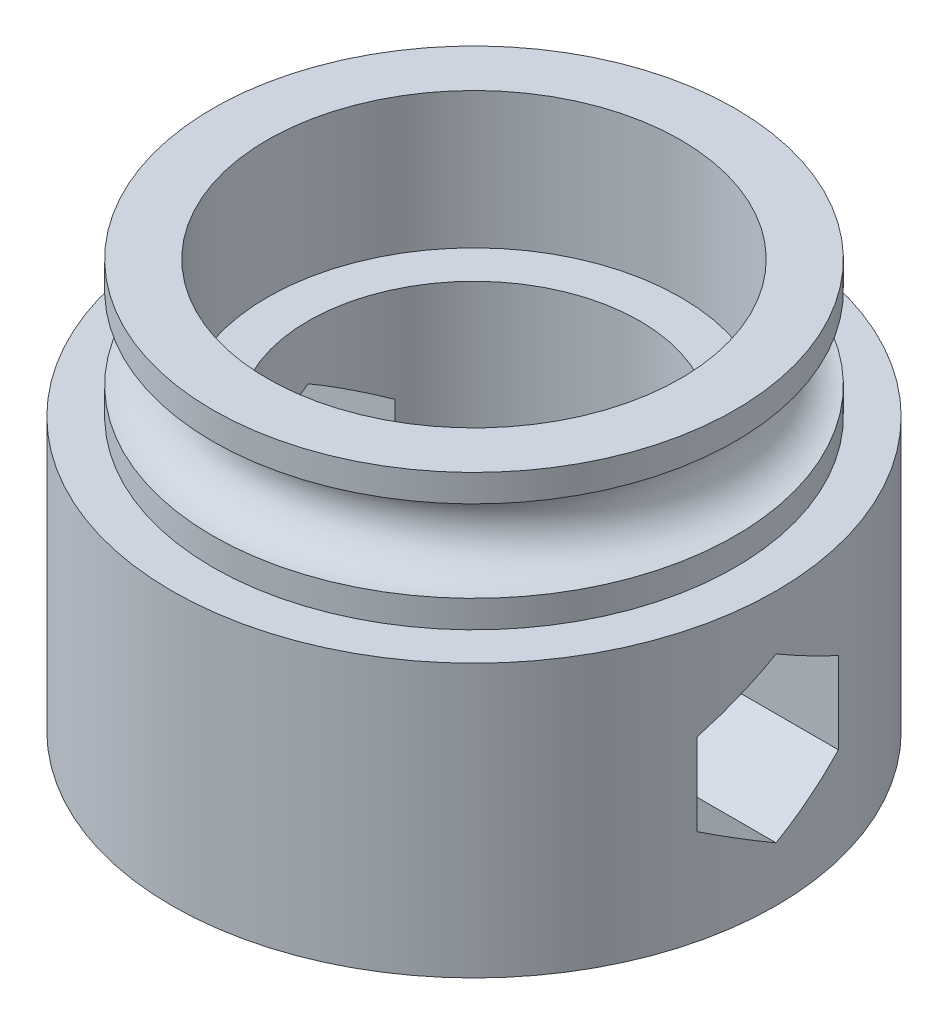
from build123d import *

# Parameters (mm, degrees)
CUT_EXTRUDE1_DEPTH      = 3.534416177
CUT_EXTRUDE1_DEPTH_BACK = 3.534416177


with BuildPart() as part:
    # Sketch3 → Revolve1 (revolve)
    with BuildSketch(Plane.XY, mode=Mode.PRIVATE) as revolve1_sk:
        with BuildLine():
            ThreePointArc((0.35, 1.4), (0.2, 1.25), (0.35, 1.1))
            Line((0.35, 1.1), (0.35, 1))
            Line((0.35, 1), (0.5, 1))
            Line((0.5, 1), (0.5, 0))
            Line((0.5, 0), (0, 0))
            Line((0, 0), (0, 1))
            Line((0, 1), (0.15, 1))
            Line((0.15, 1), (0.15, 1.5))
            Line((0.15, 1.5), (0.35, 1.5))
            Line((0.35, 1.5), (0.35, 1.4))
        make_face()
    revolve(revolve1_sk.sketch.rotate(Axis((-0.608104109, 0, 0), (0, 1, 0)), 90), axis=Axis((-0.608104109, 0, 0), (0, 1, 0)))

    # Sketch11 → Cut-Extrude1 (cut, two sides: drawn at the far end of the back side and taken through both)
    with BuildSketch(Plane(origin=(0, 0, 0), x_dir=(0, 0, -1), z_dir=(1, 0, 0)).offset(-CUT_EXTRUDE1_DEPTH_BACK)):
        Polygon((0, 0.8), (-0.259807621, 0.65), (-0.259807621, 0.35), (0, 0.2), (0.259807621, 0.35), (0.259807621, 0.65), align=None)
    extrude(amount=CUT_EXTRUDE1_DEPTH + CUT_EXTRUDE1_DEPTH_BACK, mode=Mode.SUBTRACT)


solid = part.part
